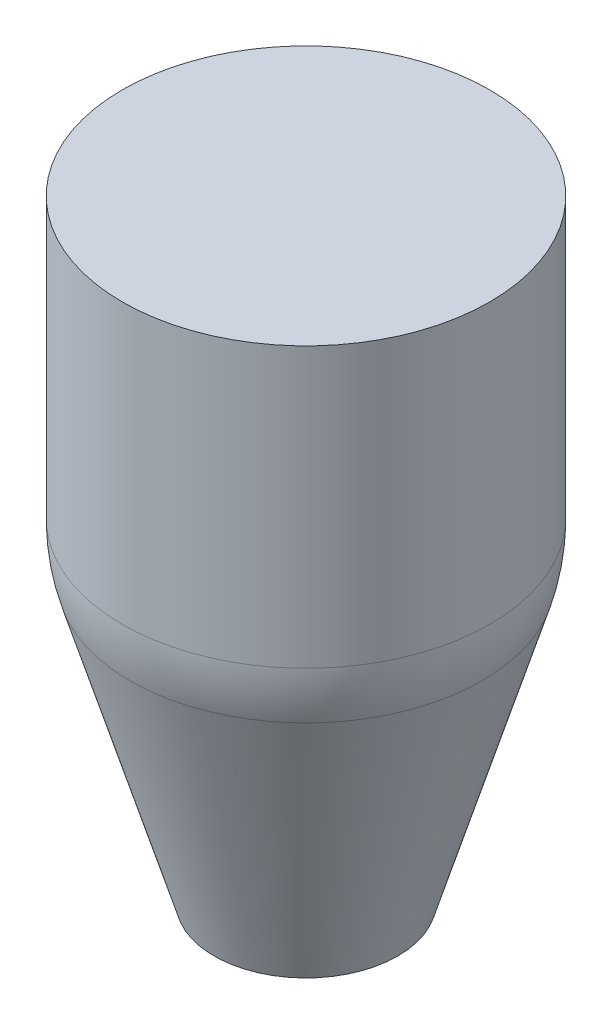
from build123d import *


with BuildPart() as part:
    # Sketch3 → Revolve1 (revolve)
    with BuildSketch(Plane.XY, mode=Mode.PRIVATE) as revolve1_sk:
        with BuildLine():
            Line((0, 100), (0, 0))
            Line((0, 0), (15, 0))
            Line((15, 0), (28.734788557, 45.782628522))
            ThreePointArc((28.734788557, 45.782628522), (29.682011865, 50.046670749), (30, 54.403065089))
            Line((30, 54.403065089), (30, 100))
            Line((30, 100), (0, 100))
        make_face()
    revolve(revolve1_sk.sketch.rotate(Axis((0, 100, 0), (0, -1, 0)), 180), axis=Axis((0, 100, 0), (0, -1, 0)))


solid = part.part
